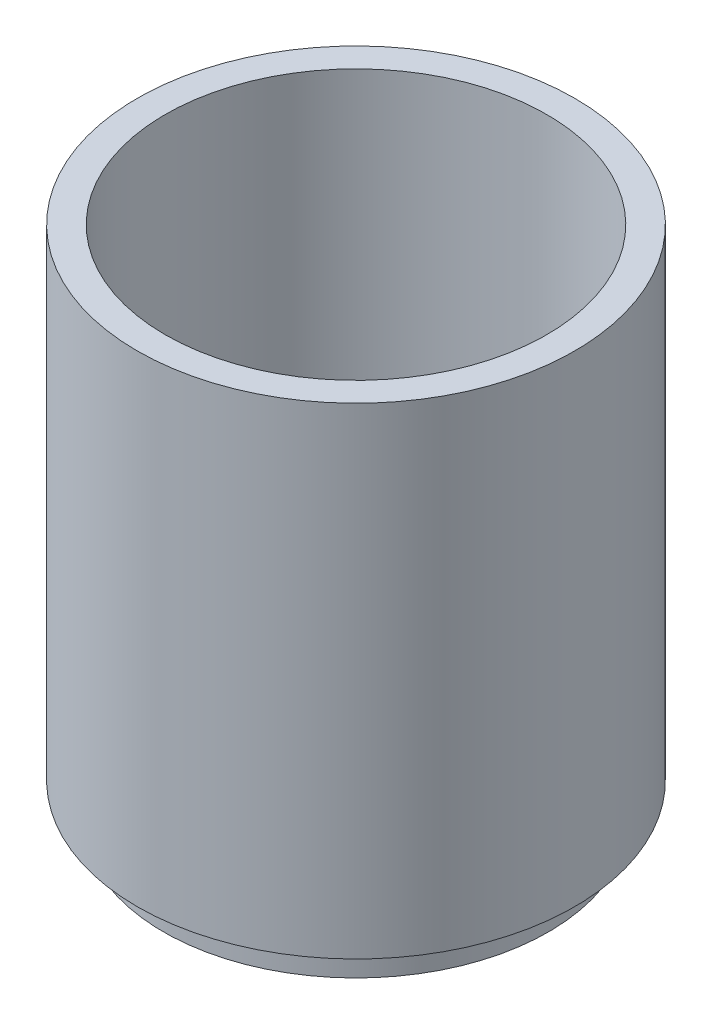
from build123d import *

# Parameters (mm, degrees)
SKETCH1_R           = 31.75
BOSS_EXTRUDE1_DEPTH = 69.85
SKETCH2_R           = 27.686
CUT_EXTRUDE1_DEPTH  = 63.5
SKETCH3_R           = 27.94
BOSS_EXTRUDE2_DEPTH = 5.08


with BuildPart() as part:
    # Sketch1 → Boss-Extrude1 (new body)
    with BuildSketch(Plane(origin=(0, 0, 0), x_dir=(1, 0, 0), z_dir=(0, 1, 0))):
        with Locations(Location((0, 0, 0), (0, 0, 270))):
            Circle(SKETCH1_R)
    extrude(amount=BOSS_EXTRUDE1_DEPTH)

    # Sketch2 → Cut-Extrude1 (cut)
    with BuildSketch(Plane(origin=(0, 69.85, 0), x_dir=(1, 0, 0), z_dir=(0, 1, 0))):
        with Locations(Location((0, 0, 0), (0, 0, 270))):
            Circle(SKETCH2_R)
    extrude(amount=-CUT_EXTRUDE1_DEPTH, mode=Mode.SUBTRACT)

    # Sketch3 → Boss-Extrude2 (add)
    with BuildSketch(Plane.XZ):
        with Locations(Location((0, 0, 0), (0, 0, 270))):
            Circle(SKETCH3_R)
    extrude(amount=BOSS_EXTRUDE2_DEPTH)


solid = part.part
